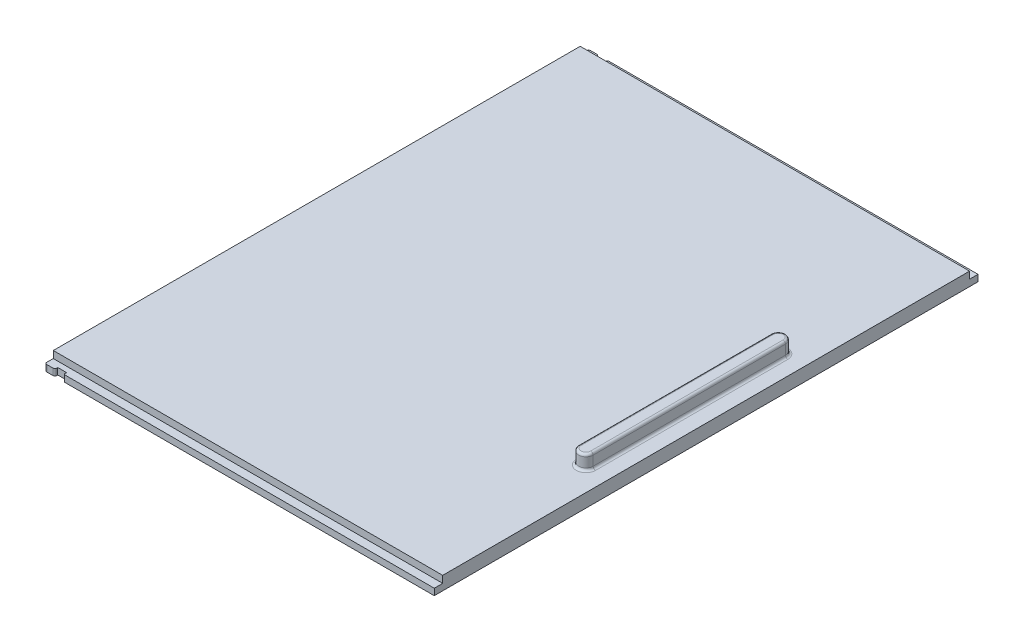
from build123d import *

# Parameters (mm, degrees)
SKETCH1_W           = 81
SKETCH1_H           = 116
BOSS_EXTRUDE1_DEPTH = 3
CUT_EXTRUDE2_DEPTH  = 81
CUT_EXTRUDE3_DEPTH  = 81
SKETCH6_W           = 1.85
SKETCH6_H           = 1.55
CUT_EXTRUDE5_DEPTH  = 0.6
FILLET6_R           = 0.4
CHAMFER2_SIZE       = 0.2
SKETCH7_W           = 1.85
SKETCH7_H           = 1.55
CUT_EXTRUDE6_DEPTH  = 0.6
FILLET7_R           = 0.4
CHAMFER3_SIZE       = 0.2
SKETCH10_W          = 81
SKETCH10_H          = 113.1
CUT_EXTRUDE7_DEPTH  = 0.2
FILLET8_R           = 0.4
BOSS_EXTRUDE2_DEPTH = 3
FILLET10_R          = 0.5


with BuildPart() as part:
    # Sketch1 → Boss-Extrude1 (new body)
    with BuildSketch(Plane(origin=(0, 0, 0), x_dir=(1, 0, 0), z_dir=(0, 1, 0))):
        with Locations((40.5, 58)):
            Rectangle(SKETCH1_W, SKETCH1_H)
    extrude(amount=BOSS_EXTRUDE1_DEPTH)

    # Sketch2 → Cut-Extrude2 (cut)
    with BuildSketch(Plane(origin=(81, 0, 0), x_dir=(0, 0, -1), z_dir=(1, 0, 0))):
        Polygon((0, 3), (3, 3), (3, 1.75), (1.25, 1.75), (1.25, 0), (0, 0), align=None)
        Polygon((114.75, 0), (116, 0), (116, 3), (113, 3), (113, 1.75), (114.75, 1.75), align=None)
    extrude(amount=-CUT_EXTRUDE2_DEPTH, mode=Mode.SUBTRACT)

    # Sketch4 → Cut-Extrude3 (cut)
    with BuildSketch(Plane(origin=(81, 0, 0), x_dir=(0, 0, -1), z_dir=(1, 0, 0))):
        Polygon((3.2, 3), (3, 3), (3, 1.75), (1.25, 1.75), (1.25, 0), (1.45, 0), (1.45, 1.55), (3.2, 1.55), align=None)
        Polygon((114.75, 0), (114.55, 0), (114.55, 1.55), (112.8, 1.55), (112.8, 3), (113, 3), (113, 1.75), (114.75, 1.75), align=None)
    extrude(amount=-CUT_EXTRUDE3_DEPTH, mode=Mode.SUBTRACT)

    # Sketch6 → Cut-Extrude5 (cut)
    with BuildSketch(Plane.XY.offset(-1.45)):
        with Locations((3, 0.775)):
            Rectangle(SKETCH6_W, SKETCH6_H)
    extrude(amount=-CUT_EXTRUDE5_DEPTH, mode=Mode.SUBTRACT)

    # Fillet6
    fillet6_edges = [part.edges().sort_by_distance(p)[0] for p in [
        (2.075, 0.775, -1.45),
    ]]
    fillet(fillet6_edges, radius=FILLET6_R)

    # Chamfer2
    chamfer2_edges = [part.edges().sort_by_distance(p)[0] for p in [
        (3.925, 0.775, -1.45),
    ]]
    chamfer(chamfer2_edges, length=CHAMFER2_SIZE)

    # Sketch7 → Cut-Extrude6 (cut)
    with BuildSketch(Plane(origin=(0, 0, -114.55), x_dir=(-1, 0, 0), z_dir=(0, 0, -1))):
        with Locations((-3, 0.775)):
            Rectangle(SKETCH7_W, SKETCH7_H)
    extrude(amount=-CUT_EXTRUDE6_DEPTH, mode=Mode.SUBTRACT)

    # Fillet7
    fillet7_edges = [part.edges().sort_by_distance(p)[0] for p in [
        (2.075, 0.775, -114.55),
    ]]
    fillet(fillet7_edges, radius=FILLET7_R)

    # Chamfer3
    chamfer3_edges = [part.edges().sort_by_distance(p)[0] for p in [
        (3.925, 0.775, -114.55),
    ]]
    chamfer(chamfer3_edges, length=CHAMFER3_SIZE)

    # Sketch10 → Cut-Extrude7 (cut)
    with BuildSketch(Plane(origin=(0, 0, 0), x_dir=(-1, 0, 0), z_dir=(0, -1, 0))):
        with Locations((-40.5, 58)):
            Rectangle(SKETCH10_W, SKETCH10_H)
    extrude(amount=-CUT_EXTRUDE7_DEPTH, mode=Mode.SUBTRACT)

    # Fillet8
    fillet8_edges = [part.edges().sort_by_distance(p)[0] for p in [
        (0, 0.875, -114.55),
        (0, 0.875, -1.45),
    ]]
    fillet(fillet8_edges, radius=FILLET8_R)

    # Sketch9 → Boss-Extrude2 (add)
    with BuildSketch(Plane(origin=(0, 3, 0), x_dir=(1, 0, 0), z_dir=(0, 1, 0))):
        with BuildLine():
            Line((74.5, 38), (74.5, 78))
            ThreePointArc((74.5, 78), (76, 79.5), (77.5, 78))
            Line((77.5, 78), (77.5, 38))
            ThreePointArc((77.5, 38), (76, 36.5), (74.5, 38))
        make_face()
    extrude(amount=BOSS_EXTRUDE2_DEPTH)

    # Fillet10
    fillet10_edges = [part.edges().sort_by_distance(p)[0] for p in [
        (76, 3, -36.5),
        (77.5, 3, -58),
        (76, 3, -79.5),
        (74.5, 3, -58),
        (76, 6, -36.5),
        (77.5, 6, -58),
        (76, 6, -79.5),
        (74.5, 6, -58),
    ]]
    fillet(fillet10_edges, radius=FILLET10_R)


solid = part.part
